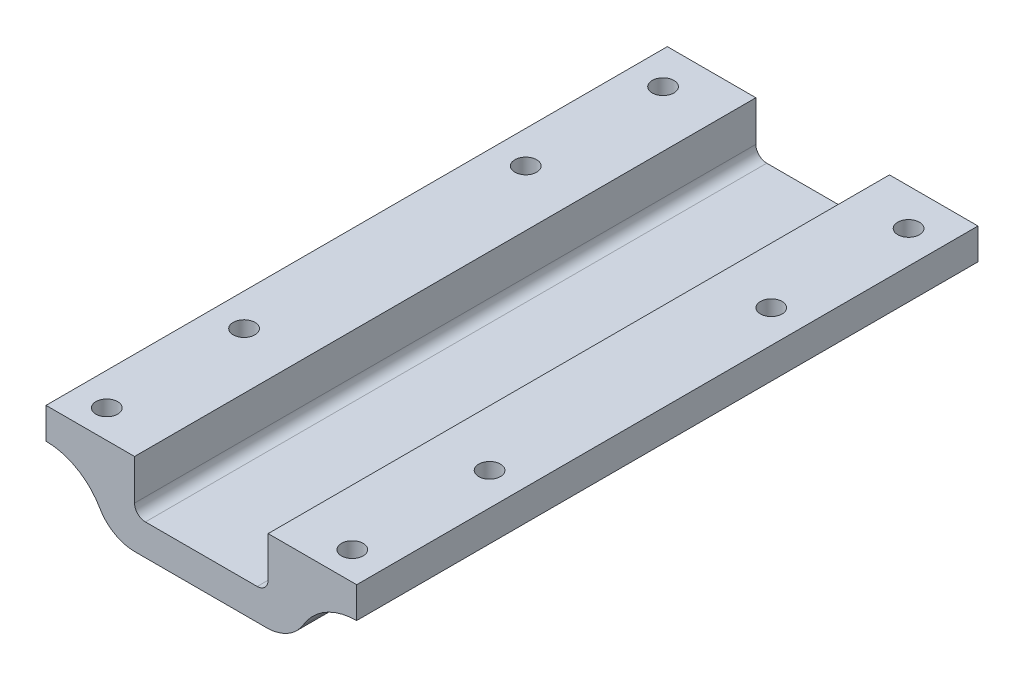
from build123d import *

# Parameters (mm, degrees)
BOSS_EXTRUDE1_DEPTH = 100
SKETCH2_R           = 1.75
CUT_EXTRUDE1_DEPTH  = 113.585800614
CUT_EXTRUDE2_DEPTH  = 8.25


with BuildPart() as part:
    # Sketch1 → Boss-Extrude1 (new body)
    with BuildSketch(Plane.XY):
        with BuildLine():
            Line((50, 10.224622738), (50, 5.224622738))
            ThreePointArc((50, 5.224622738), (45, 3.884876776), (41.339745962, 0.224622738))
            ThreePointArc((41.339745962, 0.224622738), (38.927083678, -2.096523604), (35.710580838, -3.025377262))
            Line((35.710580838, -3.025377262), (14.289419162, -3.025377262))
            ThreePointArc((14.289419162, -3.025377262), (11.039419162, -2.154542386), (8.660254038, 0.224622738))
            ThreePointArc((8.660254038, 0.224622738), (5, 3.884876776), (0, 5.224622738))
            Line((0, 5.224622738), (0, 10.224622738))
            Line((0, 10.224622738), (14.25, 10.224622738))
            Line((14.25, 10.224622738), (14.25, 3.724622738))
            ThreePointArc((14.25, 3.724622738), (14.762563133, 2.487185871), (16, 1.974622738))
            Line((16, 1.974622738), (34, 1.974622738))
            ThreePointArc((34, 1.974622738), (35.237436867, 2.487185871), (35.75, 3.724622738))
            Line((35.75, 3.724622738), (35.75, 10.224622738))
            Line((35.75, 10.224622738), (50, 10.224622738))
        make_face()
    extrude(amount=-BOSS_EXTRUDE1_DEPTH)

    # Sketch2 → Cut-Extrude1 (cut, through all)
    with BuildSketch(Plane.XZ.offset(3.025377262)):
        with Locations(Location((44.756824718, -26.634894448, 0), (0, 0, 270))):
            Circle(SKETCH2_R)
        with Locations(Location((44.756824718, -4.537105649, 0), (0, 0, 270))):
            Circle(SKETCH2_R)
        with Locations(Location((44.756824718, -71.972969116, 0), (0, 0, 270))):
            Circle(SKETCH2_R)
        with Locations(Location((44.756824718, -94.070757915, 0), (0, 0, 270))):
            Circle(SKETCH2_R)
        with Locations(Location((5.243175282, -71.972969116, 0), (0, 0, 270))):
            Circle(SKETCH2_R)
        with Locations(Location((5.243175282, -94.070757915, 0), (0, 0, 270))):
            Circle(SKETCH2_R)
        with Locations(Location((5.243175282, -26.634894448, 0), (0, 0, 270))):
            Circle(SKETCH2_R)
        with Locations(Location((5.243175282, -4.537105649, 0), (0, 0, 270))):
            Circle(SKETCH2_R)
    extrude(amount=-CUT_EXTRUDE1_DEPTH, mode=Mode.SUBTRACT)

    # Sketch3 → Cut-Extrude2 (cut)
    with BuildSketch(Plane.XZ.offset(3.025377262)):
        Polygon((8.243175282, -2.805054841), (5.243175282, -1.073004033), (2.243175282, -2.805054841), (2.243175282, -6.269156456), (5.243175282, -8.001207264), (8.243175282, -6.269156456), align=None)
        Polygon((5.264020111, -23.170855549), (2.25365201, -24.884822847), (2.232807181, -28.348861746), (5.222330453, -30.098933346), (8.232698554, -28.384966048), (8.253543382, -24.920927149), align=None)
        Polygon((41.746456618, -24.920927149), (44.735979889, -23.170855549), (47.74634799, -24.884822847), (47.767192819, -28.348861746), (44.777669547, -30.098933346), (41.767301446, -28.384966048), align=None)
        Polygon((41.756824718, -6.269156456), (41.756824718, -2.805054841), (44.756824718, -1.073004033), (47.756824718, -2.805054841), (47.756824718, -6.269156456), (44.756824718, -8.001207264), align=None)
        Polygon((41.756824718, -92.338707108), (44.756824718, -90.6066563), (47.756824718, -92.338707108), (47.756824718, -95.802808723), (44.756824718, -97.534859531), (41.756824718, -95.802808723), align=None)
        Polygon((5.251618805, -68.508877791), (2.247405955, -70.233611149), (2.238962432, -73.697702473), (5.234731759, -75.437060441), (8.238944609, -73.712327084), (8.247388132, -70.248235759), align=None)
        Polygon((5.243175282, -90.6066563), (2.243175282, -92.338707108), (2.243175282, -95.802808723), (5.243175282, -97.534859531), (8.243175282, -95.802808723), (8.243175282, -92.338707108), align=None)
        Polygon((41.752611868, -70.248235759), (44.748381195, -68.508877791), (47.752594045, -70.233611149), (47.761037568, -73.697702473), (44.765268241, -75.437060441), (41.761055391, -73.712327084), align=None)
    extrude(amount=-CUT_EXTRUDE2_DEPTH, mode=Mode.SUBTRACT)


solid = part.part
